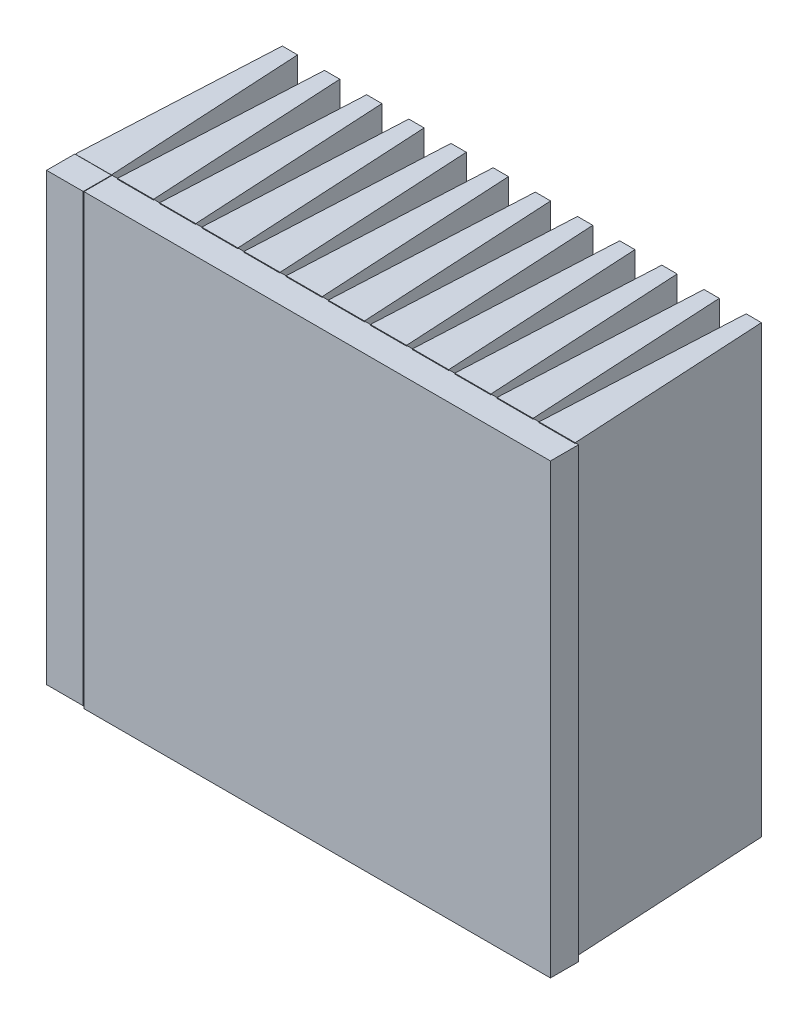
from build123d import *

# Parameters (mm, degrees)
BOSS_EXTRUDE2_DEPTH    = 79000
BOSS_EXTRUDE2_2_DEPTH  = 79000
BOSS_EXTRUDE2_3_DEPTH  = 79000
BOSS_EXTRUDE2_4_DEPTH  = 79000
BOSS_EXTRUDE2_5_DEPTH  = 79000
BOSS_EXTRUDE2_6_DEPTH  = 79000
BOSS_EXTRUDE2_7_DEPTH  = 79000
BOSS_EXTRUDE2_8_DEPTH  = 79000
BOSS_EXTRUDE2_9_DEPTH  = 79000
BOSS_EXTRUDE2_10_DEPTH = 79000
BOSS_EXTRUDE2_11_DEPTH = 79000
BOSS_EXTRUDE2_12_DEPTH = 79000
SKETCH1_W              = 6500
SKETCH1_H              = 79000
BOSS_EXTRUDE3_DEPTH    = 5000
SKETCH5_W              = 5000
SKETCH5_H              = 79411.709707549
BOSS_EXTRUDE4_DEPTH    = 82730


with BuildPart() as part:
    # Sketch2 → Boss-Extrude2 (new body)
    with BuildSketch(Plane(origin=(0, 0, 0), x_dir=(1, 0, 0), z_dir=(0, 1, 0))):
        Polygon((0, 0), (1767.735100562, 34955.330246105), (4484.445899835, 34947.079637387), (6408.406611002, 0), align=None)
    extrude(amount=BOSS_EXTRUDE2_DEPTH)

    # Sketch1 → Boss-Extrude3 (add)
    with BuildSketch(Plane.XY):
        with Locations((3158.406611002, 39458.149234792)):
            Rectangle(SKETCH1_W, SKETCH1_H)
    extrude(amount=BOSS_EXTRUDE3_DEPTH)

    # Sketch5 → Boss-Extrude4 (add)
    with BuildSketch(Plane(origin=(6408.406611002, 864.469640722, -1423.254135241), x_dir=(0, 0, -1), z_dir=(1, 0, 0))):
        with Locations((-3790.271139959, 38293.212450306)):
            Rectangle(SKETCH5_W, SKETCH5_H)
    extrude(amount=BOSS_EXTRUDE4_DEPTH)


with BuildPart() as body_2:
    # Sketch2 → Boss-Extrude2 2 (new body)
    with BuildSketch(Plane(origin=(0, 0, 0), x_dir=(1, 0, 0), z_dir=(0, 1, 0))):
        Polygon((7478.055691895, 0), (9245.790792456, 34955.330246105), (11962.50159173, 34947.079637387), (13886.462302897, 0), align=None)
    extrude(amount=BOSS_EXTRUDE2_2_DEPTH)


with BuildPart() as body_3:
    # Sketch2 → Boss-Extrude2 3 (new body)
    with BuildSketch(Plane(origin=(0, 0, 0), x_dir=(1, 0, 0), z_dir=(0, 1, 0))):
        Polygon((14956.111383789, 0), (16723.846484351, 34955.330246105), (19440.557283624, 34947.079637387), (21364.517994792, 0), align=None)
    extrude(amount=BOSS_EXTRUDE2_3_DEPTH)


with BuildPart() as body_4:
    # Sketch2 → Boss-Extrude2 4 (new body)
    with BuildSketch(Plane(origin=(0, 0, 0), x_dir=(1, 0, 0), z_dir=(0, 1, 0))):
        Polygon((22434.167075684, 0), (24201.902176245, 34955.330246105), (26918.612975519, 34947.079637387), (28842.573686686, 0), align=None)
    extrude(amount=BOSS_EXTRUDE2_4_DEPTH)


with BuildPart() as body_5:
    # Sketch2 → Boss-Extrude2 5 (new body)
    with BuildSketch(Plane(origin=(0, 0, 0), x_dir=(1, 0, 0), z_dir=(0, 1, 0))):
        Polygon((29912.222767578, 0), (31679.95786814, 34955.330246105), (34396.668667414, 34947.079637387), (36320.629378581, 0), align=None)
    extrude(amount=BOSS_EXTRUDE2_5_DEPTH)


with BuildPart() as body_6:
    # Sketch2 → Boss-Extrude2 6 (new body)
    with BuildSketch(Plane(origin=(0, 0, 0), x_dir=(1, 0, 0), z_dir=(0, 1, 0))):
        Polygon((37390.278459473, 0), (39158.013560035, 34955.330246105), (41874.724359308, 34947.079637387), (43798.685070475, 0), align=None)
    extrude(amount=BOSS_EXTRUDE2_6_DEPTH)


with BuildPart() as body_7:
    # Sketch2 → Boss-Extrude2 7 (new body)
    with BuildSketch(Plane(origin=(0, 0, 0), x_dir=(1, 0, 0), z_dir=(0, 1, 0))):
        Polygon((44868.334151367, 0), (46636.069251929, 34955.330246105), (49352.780051203, 34947.079637387), (51276.74076237, 0), align=None)
    extrude(amount=BOSS_EXTRUDE2_7_DEPTH)


with BuildPart() as body_8:
    # Sketch2 → Boss-Extrude2 8 (new body)
    with BuildSketch(Plane(origin=(0, 0, 0), x_dir=(1, 0, 0), z_dir=(0, 1, 0))):
        Polygon((52346.389843262, 0), (54114.124943824, 34955.330246105), (56830.835743097, 34947.079637387), (58754.796454264, 0), align=None)
    extrude(amount=BOSS_EXTRUDE2_8_DEPTH)


with BuildPart() as body_9:
    # Sketch2 → Boss-Extrude2 9 (new body)
    with BuildSketch(Plane(origin=(0, 0, 0), x_dir=(1, 0, 0), z_dir=(0, 1, 0))):
        Polygon((59824.445535156, 0), (61592.180635718, 34955.330246105), (64308.891434992, 34947.079637387), (66232.852146159, 0), align=None)
    extrude(amount=BOSS_EXTRUDE2_9_DEPTH)


with BuildPart() as body_10:
    # Sketch2 → Boss-Extrude2 10 (new body)
    with BuildSketch(Plane(origin=(0, 0, 0), x_dir=(1, 0, 0), z_dir=(0, 1, 0))):
        Polygon((67302.501227051, 0), (69070.236327613, 34955.330246105), (71786.947126886, 34947.079637387), (73710.907838053, 0), align=None)
    extrude(amount=BOSS_EXTRUDE2_10_DEPTH)


with BuildPart() as body_11:
    # Sketch2 → Boss-Extrude2 11 (new body)
    with BuildSketch(Plane(origin=(0, 0, 0), x_dir=(1, 0, 0), z_dir=(0, 1, 0))):
        Polygon((74780.556918946, 0), (76548.292019507, 34955.330246105), (79265.002818781, 34947.079637387), (81188.963529948, 0), align=None)
    extrude(amount=BOSS_EXTRUDE2_11_DEPTH)


with BuildPart() as body_12:
    # Sketch2 → Boss-Extrude2 12 (new body)
    with BuildSketch(Plane(origin=(0, 0, 0), x_dir=(1, 0, 0), z_dir=(0, 1, 0))):
        Polygon((82258.61261084, 0), (84026.347711402, 34955.330246105), (86743.058510675, 34947.079637387), (88667.019221843, 0), align=None)
    extrude(amount=BOSS_EXTRUDE2_12_DEPTH)


solid = Compound([part.part, body_2.part, body_3.part, body_4.part, body_5.part, body_6.part, body_7.part, body_8.part, body_9.part, body_10.part, body_11.part, body_12.part])
